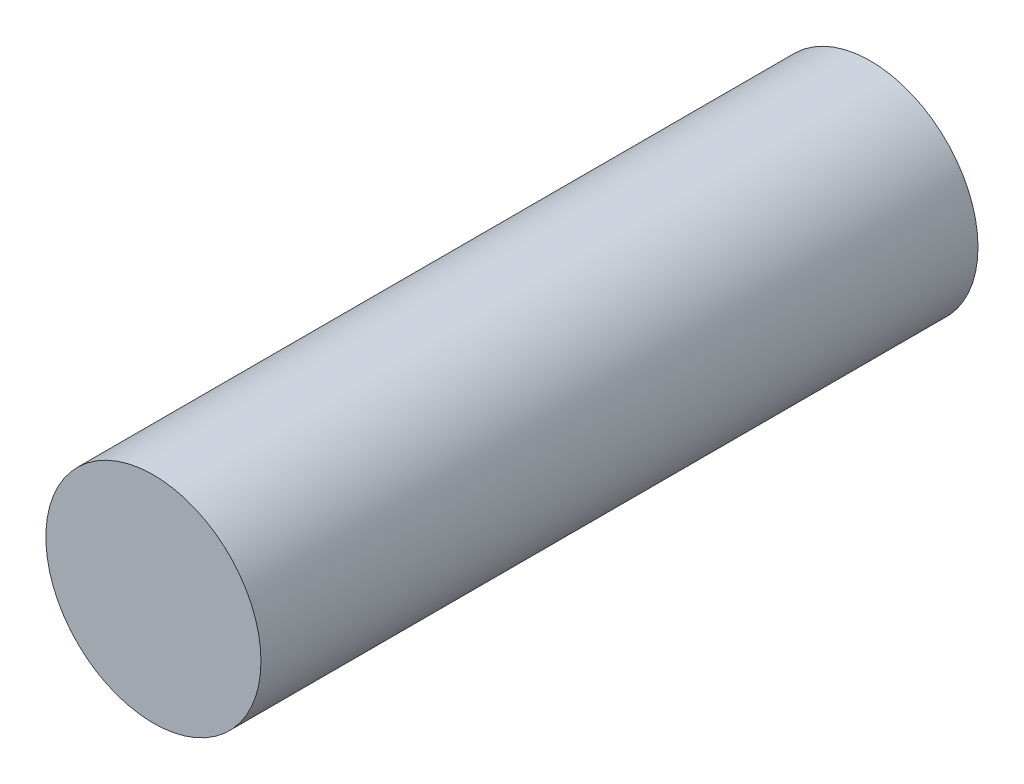
from build123d import *

# Parameters (mm, degrees)
SKETCH1_R           = 1.5
BOSS_EXTRUDE1_DEPTH = 10
SKETCH2_R           = 0.79375
CUT_EXTRUDE1_DEPTH  = 3.5


with BuildPart() as part:
    # Sketch1 → Boss-Extrude1 (new body)
    with BuildSketch(Plane.XY):
        Circle(SKETCH1_R)
    extrude(amount=BOSS_EXTRUDE1_DEPTH)

    # Sketch2 → Cut-Extrude1 (cut)
    with BuildSketch(Plane(origin=(0, 0, 0), x_dir=(-1, 0, 0), z_dir=(0, 0, -1))):
        Circle(SKETCH2_R)
    extrude(amount=-CUT_EXTRUDE1_DEPTH, mode=Mode.SUBTRACT)


solid = part.part
